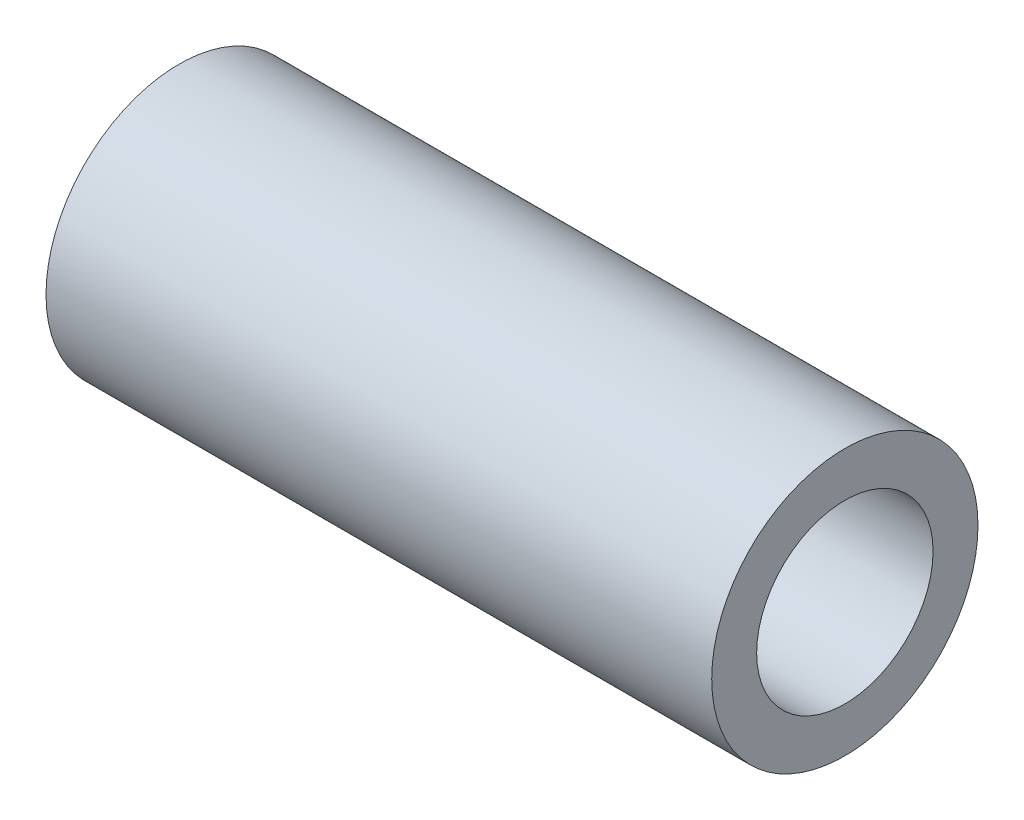
from build123d import *

# Parameters (mm, degrees)
SKETCH1_R           = 4
SKETCH1_R_2         = 2.65
BOSS_EXTRUDE1_DEPTH = 20


with BuildPart() as part:
    # Sketch1 → Boss-Extrude1 (new body)
    with BuildSketch(Plane(origin=(0, 0, 0), x_dir=(0, 0, -1), z_dir=(1, 0, 0))):
        Circle(SKETCH1_R)
        Circle(SKETCH1_R_2, mode=Mode.SUBTRACT)
    extrude(amount=BOSS_EXTRUDE1_DEPTH)


solid = part.part
